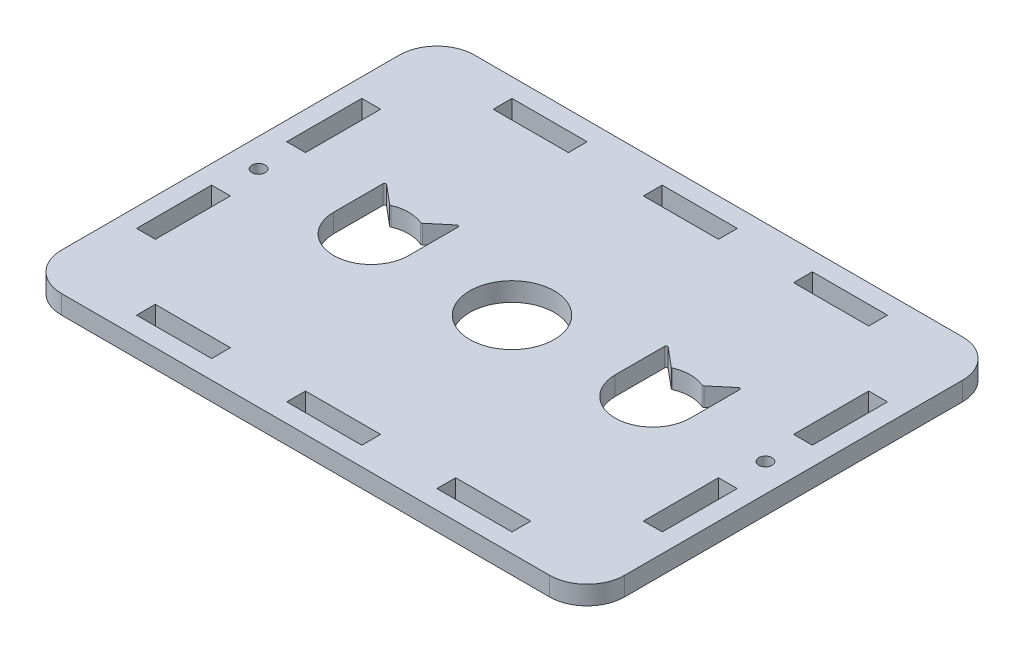
from build123d import *

# Parameters (mm, degrees)
SKETCH1_W                 = 190.5
SKETCH1_H                 = 139.7
BOSS_EXTRUDE1_DEPTH       = 6.35
SKETCH13_W                = 25.4
SKETCH13_H                = 6.35
CUT_EXTRUDE6_DEPTH        = 6.35
LPATTERN7_COUNT           = 2
LPATTERN7_PITCH           = 120.65
SKETCH14_W                = 6.35
SKETCH14_H                = 25.4
CUT_EXTRUDE7_DEPTH        = 6.35
F_8_CLEARANCE_HOLE1_D     = 4.4958
F_8_CLEARANCE_HOLE1_DEPTH = 10.16
F_8_CLEARANCE_HOLE1_TIP   = 1.350674586
SKETCH18_R                = 14.2875
CUT_EXTRUDE9_DEPTH        = 7.62
CUT_EXTRUDE16_DEPTH       = 6.35
FILLET2_R                 = 0.508
CUT_EXTRUDE17_DEPTH       = 6.35
FILLET5_R                 = 0.508
FILLET6_R                 = 12.7


with BuildPart() as part:
    # Sketch1 → Boss-Extrude1 (new body)
    with BuildSketch(Plane(origin=(0, 0, 0), x_dir=(1, 0, 0), z_dir=(0, 1, 0))):
        with Locations((95.25, 69.85)):
            Rectangle(SKETCH1_W, SKETCH1_H)
    extrude(amount=BOSS_EXTRUDE1_DEPTH)

    # Sketch13 → Cut-Extrude6 (cut)
    with BuildSketch(Plane(origin=(0, 6.35, 0), x_dir=(1, 0, 0), z_dir=(0, 1, 0))):
        with Locations((44.45, 9.525)):
            Rectangle(SKETCH13_W, SKETCH13_H)
        with Locations((95.25, 9.525)):
            Rectangle(SKETCH13_W, SKETCH13_H)
        with Locations((146.05, 9.525)):
            Rectangle(SKETCH13_W, SKETCH13_H)
    cut_extrude6 = extrude(amount=-CUT_EXTRUDE6_DEPTH, mode=Mode.SUBTRACT)

    # LPattern7: Cut-Extrude6 ×2
    with Locations(*[(0, 0, -i * LPATTERN7_PITCH) for i in range(1, LPATTERN7_COUNT)]):
        add(cut_extrude6, mode=Mode.SUBTRACT)

    # Sketch14 → Cut-Extrude7 (cut)
    with BuildSketch(Plane(origin=(0, 6.35, 0), x_dir=(1, 0, 0), z_dir=(0, 1, 0))):
        with Locations((9.525, 44.45)):
            Rectangle(SKETCH14_W, SKETCH14_H)
        with Locations((180.975, 44.45)):
            Rectangle(SKETCH14_W, SKETCH14_H)
        with Locations((180.975, 95.25)):
            Rectangle(SKETCH14_W, SKETCH14_H)
        with Locations((9.525, 95.25)):
            Rectangle(SKETCH14_W, SKETCH14_H)
    extrude(amount=-CUT_EXTRUDE7_DEPTH, mode=Mode.SUBTRACT)

    # #8 Clearance Hole1
    with Locations(Plane(origin=(0, 6.35, 0), x_dir=(1, 0, 0), z_dir=(0, 1, 0))):
        with Locations((9.525, 69.85), (180.975, 69.85)):
            Hole(F_8_CLEARANCE_HOLE1_D / 2, depth=F_8_CLEARANCE_HOLE1_DEPTH)
            with Locations((0, 0, -(F_8_CLEARANCE_HOLE1_DEPTH + F_8_CLEARANCE_HOLE1_TIP / 2))):  # 118° drill point
                Cone(0, F_8_CLEARANCE_HOLE1_D / 2, F_8_CLEARANCE_HOLE1_TIP, mode=Mode.SUBTRACT)

    # Sketch18 → Cut-Extrude9 (cut)
    with BuildSketch(Plane(origin=(0, 6.35, 0), x_dir=(1, 0, 0), z_dir=(0, 1, 0))):
        with Locations(Location((95.25, 69.85, 0), (0, 0, 270))):
            Circle(SKETCH18_R)
    extrude(amount=-CUT_EXTRUDE9_DEPTH, mode=Mode.SUBTRACT)

    # Sketch24 → Cut-Extrude16 (cut)
    with BuildSketch(Plane(origin=(0, 6.35, 0), x_dir=(1, 0, 0), z_dir=(0, 1, 0))):
        with BuildLine():
            Line((34.925, 87.63), (34.925, 69.85))
            ThreePointArc((34.925, 69.85), (47.625, 57.15), (60.325, 69.85))
            Line((60.325, 69.85), (60.325, 87.63))
            Line((60.325, 87.63), (52.902309744, 81.401623344))
            ThreePointArc((52.902309744, 81.401623344), (47.625, 82.55), (42.347690256, 81.401623344))
            Line((42.347690256, 81.401623344), (34.925, 87.63))
        make_face()
    extrude(amount=-CUT_EXTRUDE16_DEPTH, mode=Mode.SUBTRACT)

    # Fillet2
    fillet2_edges = [part.edges().sort_by_distance(p)[0] for p in [
        (34.925, 3.175, -87.63),
        (42.347690256, 3.175, -81.401623344),
        (52.902309744, 3.175, -81.401623344),
        (60.325, 3.175, -87.63),
    ]]
    fillet(fillet2_edges, radius=FILLET2_R)

    # Sketch25 → Cut-Extrude17 (cut)
    with BuildSketch(Plane(origin=(0, 6.35, 0), x_dir=(1, 0, 0), z_dir=(0, 1, 0))):
        with BuildLine():
            ThreePointArc((135.255, 80.01), (131.515774674, 75.529612663), (130.175, 69.85))
            ThreePointArc((130.175, 69.85), (130.178809834, 69.538944895), (130.190237052, 69.228076416))
            ThreePointArc((130.190237052, 69.228076416), (142.875, 57.15), (155.559762948, 69.228076416))
            ThreePointArc((155.559762948, 69.228076416), (155.571190166, 69.538944895), (155.575, 69.85))
            ThreePointArc((155.575, 69.85), (154.234225326, 75.529612663), (150.495, 80.01))
            ThreePointArc((150.495, 80.01), (149.361085379, 80.768823035), (148.152309744, 81.401623344))
            ThreePointArc((148.152309744, 81.401623344), (142.875, 82.55), (137.597690256, 81.401623344))
            ThreePointArc((137.597690256, 81.401623344), (136.388914621, 80.768823035), (135.255, 80.01))
        make_face()
        with BuildLine():
            Line((137.597690256, 81.401623344), (130.175, 87.63))
            Line((130.175, 87.63), (130.175, 69.85))
            ThreePointArc((130.175, 69.85), (131.515774674, 75.529612663), (135.255, 80.01))
            ThreePointArc((135.255, 80.01), (136.388914621, 80.768823035), (137.597690256, 81.401623344))
        make_face()
        with BuildLine():
            Line((155.575, 87.63), (148.152309744, 81.401623344))
            ThreePointArc((148.152309744, 81.401623344), (149.361085379, 80.768823035), (150.495, 80.01))
            ThreePointArc((150.495, 80.01), (154.234225326, 75.529612663), (155.575, 69.85))
            Line((155.575, 69.85), (155.575, 87.63))
        make_face()
    extrude(amount=-CUT_EXTRUDE17_DEPTH, mode=Mode.SUBTRACT)

    # Fillet5
    fillet5_edges = [part.edges().sort_by_distance(p)[0] for p in [
        (130.175, 3.175, -87.63),
        (137.597690256, 3.175, -81.401623344),
        (148.152309744, 3.175, -81.401623344),
        (155.575, 3.175, -87.63),
    ]]
    fillet(fillet5_edges, radius=FILLET5_R)

    # Fillet6
    fillet6_edges = [part.edges().sort_by_distance(p)[0] for p in [
        (0, 3.175, -139.7),
        (190.5, 3.175, -139.7),
        (190.5, 3.175, 0),
        (0, 3.175, 0),
    ]]
    fillet(fillet6_edges, radius=FILLET6_R)


solid = part.part
